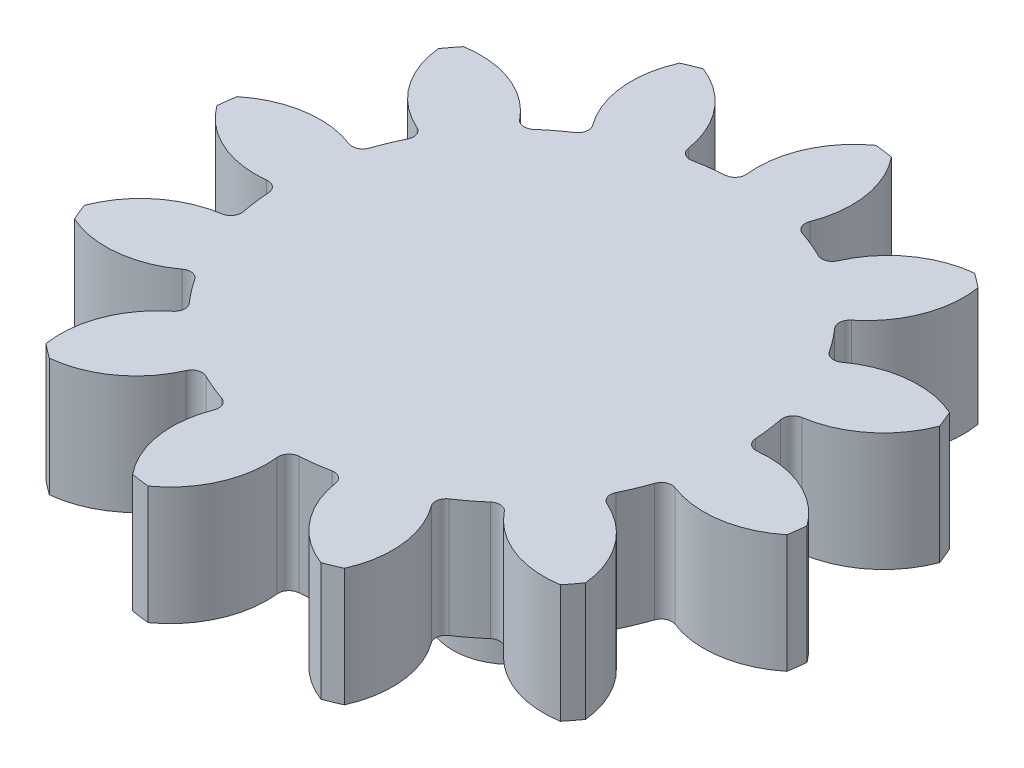
from build123d import *

# Parameters (mm, degrees)
SALIENTE_EXTRUIR1_DEPTH = 10
REDONDEO1_R             = 0.9
MATRIZC3_COUNT          = 12
REDONDEO1_OF_MATRIZC3_R = 0.9
CROQUIS3_R              = 5
SALIENTE_EXTRUIR2_DEPTH = 12
CORTAR_EXTRUIR1_DEPTH   = 6.2
REDONDEO2_R             = 1


with BuildPart() as part:
    # Croquis2 → Saliente-Extruir1 (new body)
    with BuildSketch(Plane(origin=(0, 0, 0), x_dir=(1, 0, 0), z_dir=(0, 1, 0))):
        with BuildLine():
            ThreePointArc((4.418216304, 27.649219965), (3.6652, 27.759076155), (2.909476394, 27.84842809))
            ThreePointArc((2.909476394, 27.84842809), (0.026412622, 24.07153089), (-0.280986622, 19.329957851))
            ThreePointArc((-0.280986622, 19.329957851), (-2.5305588, -19.165659294), (5.288396886, 18.594598204))
            ThreePointArc((5.288396886, 18.594598204), (6.222194872, 23.253464), (4.418216304, 27.649219965))
        make_face()
    saliente_extruir1 = extrude(amount=SALIENTE_EXTRUIR1_DEPTH)

    # Redondeo1
    redondeo1_edges = [part.edges().sort_by_distance(p)[0] for p in [
        (-0.280986622, 5, -19.329957851),
        (5.288396886, 5, -18.594598204),
    ]]
    fillet(redondeo1_edges, radius=REDONDEO1_R)

    # MatrizC3: Saliente-Extruir1 ×12 about axis
    matrizc3_axis = Axis((0, 0, 0), (0, 1, 0))
    for i in range(1, MATRIZC3_COUNT):
        add(saliente_extruir1.rotate(matrizc3_axis, i * 360 / MATRIZC3_COUNT))

    # Redondeo1 of MatrizC3
    redondeo1_of_matrizc3_edges = [part.edges().sort_by_distance(p)[0] for p in [
        (-9.908320478, 5, -16.599741242),
        (-4.717413054, 5, -18.747592861),
        (-16.880727864, 5, -9.421637373),
        (-13.459195975, 5, -13.87718515),
        (-19.329957851, 5, 0.280986622),
        (-18.594598204, 5, -5.288396886),
        (-16.599741242, 5, 9.908320478),
        (-18.747592861, 5, 4.717413054),
        (-9.421637373, 5, 16.880727864),
        (-13.87718515, 5, 13.459195975),
        (0.280986622, 5, 19.329957851),
        (-5.288396886, 5, 18.594598204),
        (9.908320478, 5, 16.599741242),
        (4.717413054, 5, 18.747592861),
        (16.880727864, 5, 9.421637373),
        (13.459195975, 5, 13.87718515),
        (19.329957851, 5, -0.280986622),
        (18.594598204, 5, 5.288396886),
        (16.599741242, 5, -9.908320478),
        (18.747592861, 5, -4.717413054),
        (9.421637373, 5, -16.880727864),
        (13.87718515, 5, -13.459195975),
    ]]
    fillet(redondeo1_of_matrizc3_edges, radius=REDONDEO1_OF_MATRIZC3_R)

    # Croquis3 → Saliente-Extruir2 (add)
    with BuildSketch(Plane.XZ):
        with Locations(Location((0, 0, 0), (0, 0, 90))):
            Circle(CROQUIS3_R)
    extrude(amount=SALIENTE_EXTRUIR2_DEPTH)

    # Croquis4 → Cortar-Extruir1 (cut)
    with BuildSketch(Plane.XZ.offset(12)):
        with BuildLine():
            Line((-2.576425576, 1.4875), (2.576425576, 1.4875))
            ThreePointArc((2.576425576, 1.4875), (0, -2.975), (-2.576425576, 1.4875))
        make_face()
    extrude(amount=-CORTAR_EXTRUIR1_DEPTH, mode=Mode.SUBTRACT)

    # Redondeo2
    redondeo2_edges = [part.edges().sort_by_distance(p)[0] for p in [
        (0, 0, -5),
    ]]
    fillet(redondeo2_edges, radius=REDONDEO2_R)


solid = part.part
